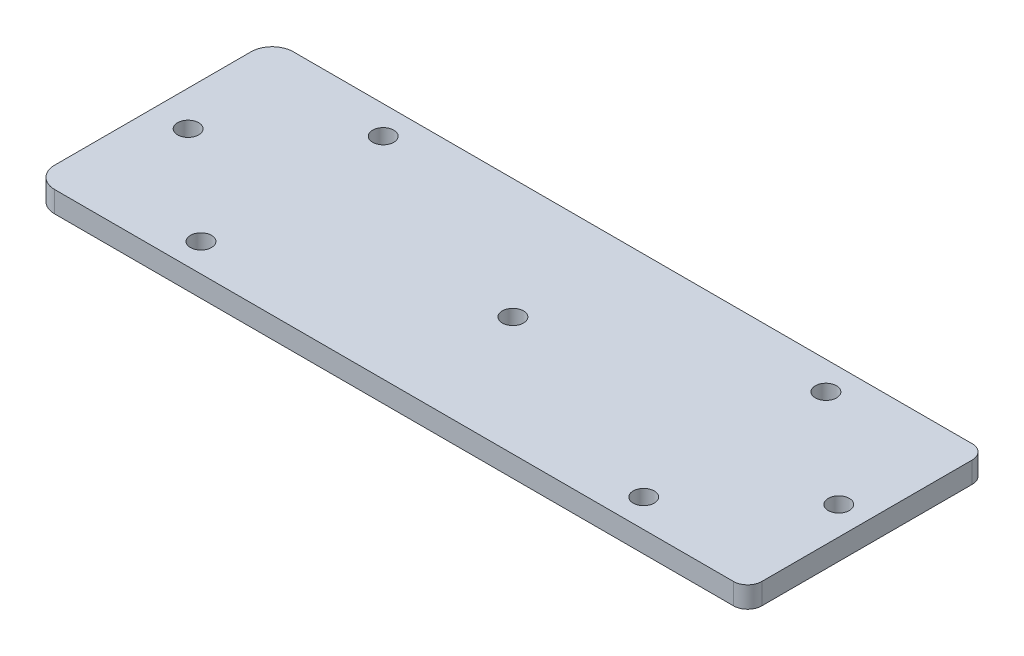
from build123d import *

# Parameters (mm, degrees)
SKETCH1_R           = 1.5
BOSS_EXTRUDE1_DEPTH = 3


with BuildPart() as part:
    # Sketch1 → Boss-Extrude1 (new body)
    with BuildSketch(Plane(origin=(0, 0, 0), x_dir=(1, 0, 0), z_dir=(0, 1, 0))):
        with BuildLine():
            Line((-56.57884372, 15.21387907), (-56.57884372, -12.63612093))
            ThreePointArc((-56.57884372, -12.63612093), (-55.700164064, -14.757441274), (-53.57884372, -15.63612093))
            Line((-53.57884372, -15.63612093), (42.72115628, -15.63612093))
            ThreePointArc((42.72115628, -15.63612093), (44.135369842, -15.050334493), (44.72115628, -13.63612093))
            Line((44.72115628, -13.63612093), (44.72115628, 16.21387907))
            ThreePointArc((44.72115628, 16.21387907), (44.135369842, 17.628092632), (42.72115628, 18.21387907))
            Line((42.72115628, 18.21387907), (-53.57884372, 18.21387907))
            ThreePointArc((-53.57884372, 18.21387907), (-55.700164064, 17.335199413), (-56.57884372, 15.21387907))
        make_face()
        with Locations(Location((40.72115628, 1.28887907, 0), (0, 0, 270))):
            Circle(SKETCH1_R, mode=Mode.SUBTRACT)
        with Locations(Location((25.97115628, 14.21387907, 0), (0, 0, 270))):
            Circle(SKETCH1_R, mode=Mode.SUBTRACT)
        with Locations(Location((-36.82884372, 14.21387907, 0), (0, 0, 270))):
            Circle(SKETCH1_R, mode=Mode.SUBTRACT)
        with Locations(Location((-51.57884372, 1.28887907, 0), (0, 0, 270))):
            Circle(SKETCH1_R, mode=Mode.SUBTRACT)
        with Locations(Location((-36.82884372, -11.63612093, 0), (0, 0, 270))):
            Circle(SKETCH1_R, mode=Mode.SUBTRACT)
        with Locations(Location((-5.42884372, 1.211546581, 0), (0, 0, 270))):
            Circle(SKETCH1_R, mode=Mode.SUBTRACT)
        with Locations(Location((25.97115628, -11.63612093, 0), (0, 0, 270))):
            Circle(SKETCH1_R, mode=Mode.SUBTRACT)
    extrude(amount=BOSS_EXTRUDE1_DEPTH)


solid = part.part
